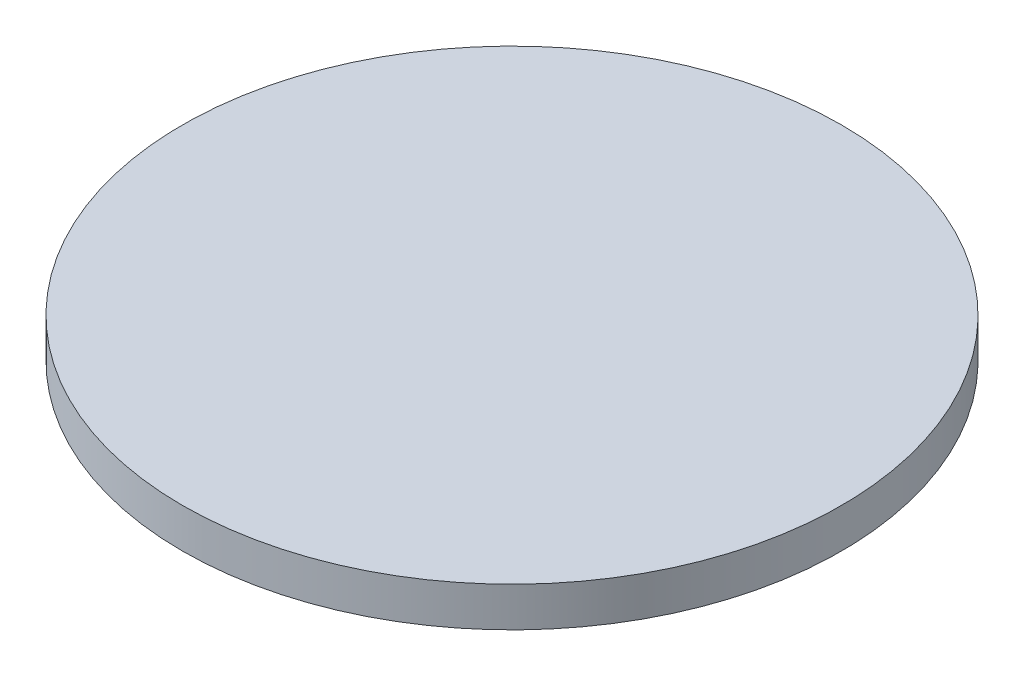
from build123d import *

# Parameters (mm, degrees)
SKETCH_1_R      = 125
EXTRUDE_1_DEPTH = 15


with BuildPart() as part:
    # 草图1 → 凸台-拉伸1 (new body)
    with BuildSketch(Plane(origin=(0, 0, 0), x_dir=(1, 0, 0), z_dir=(0, 1, 0))):
        with Locations(Location((0, 0, 0), (0, 0, 270))):
            Circle(SKETCH_1_R)
    extrude(amount=EXTRUDE_1_DEPTH)


solid = part.part
